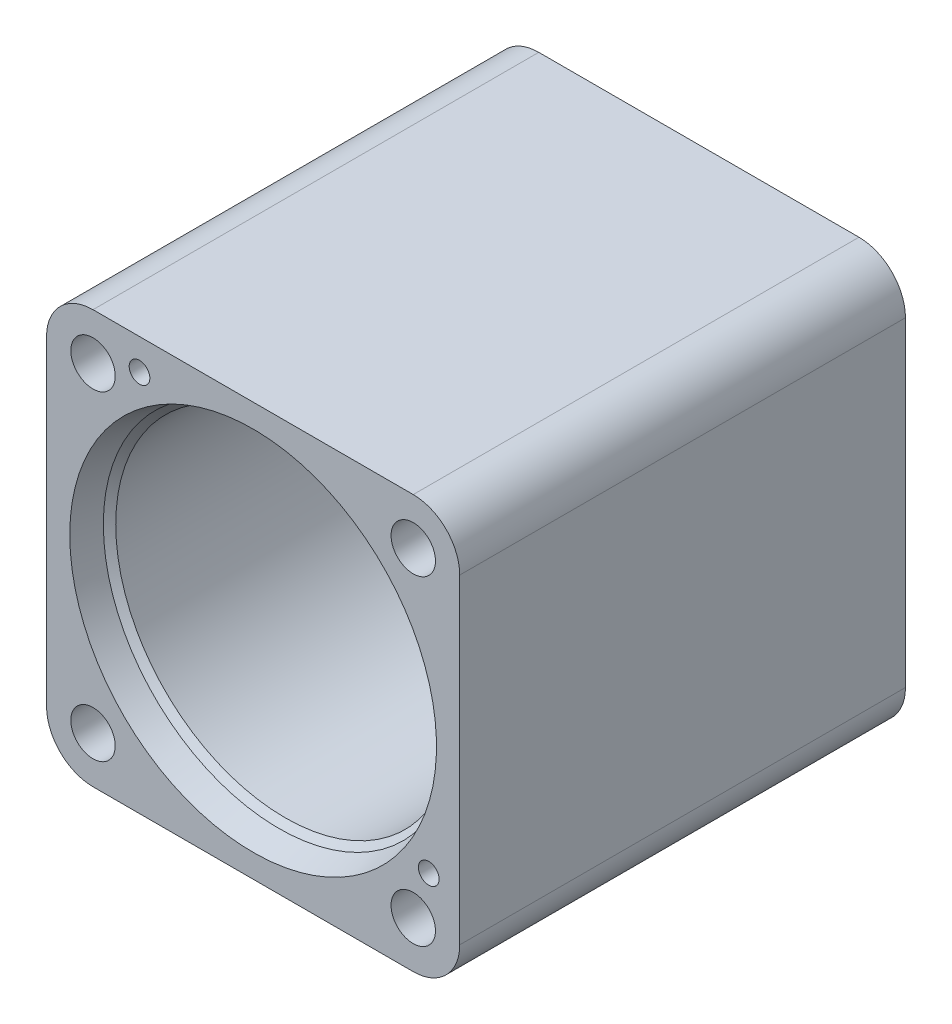
from build123d import *

# Parameters (mm, degrees)
SKETCH1_R           = 16.4
SKETCH1_R_2         = 2.15
BOSS_EXTRUDE1_DEPTH = 43.15
SKETCH6_R           = 1
CUT_EXTRUDE1_DEPTH  = 5


with BuildPart() as part:
    # Sketch1 → Boss-Extrude1 (new body)
    with BuildSketch(Plane.XY):
        with BuildLine():
            Line((-15.5, -20), (15.5, -20))
            ThreePointArc((15.5, -20), (18.681980515, -18.681980515), (20, -15.5))
            Line((20, -15.5), (20, 15.5))
            ThreePointArc((20, 15.5), (18.681980515, 18.681980515), (15.5, 20))
            Line((15.5, 20), (-15.5, 20))
            ThreePointArc((-15.5, 20), (-18.681980515, 18.681980515), (-20, 15.5))
            Line((-20, 15.5), (-20, -15.5))
            ThreePointArc((-20, -15.5), (-18.681980515, -18.681980515), (-15.5, -20))
        make_face()
        Circle(SKETCH1_R, mode=Mode.SUBTRACT)
        with Locations((-15.5, 15.5)):
            Circle(SKETCH1_R_2, mode=Mode.SUBTRACT)
        with Locations((15.5, 15.5)):
            Circle(SKETCH1_R_2, mode=Mode.SUBTRACT)
        with Locations((15.5, -15.5)):
            Circle(SKETCH1_R_2, mode=Mode.SUBTRACT)
        with Locations((-15.5, -15.5)):
            Circle(SKETCH1_R_2, mode=Mode.SUBTRACT)
    extrude(amount=BOSS_EXTRUDE1_DEPTH)

    # Sketch5 → Cut-Revolve1 (revolve, cut)
    with BuildSketch(Plane(origin=(0, 0, 0), x_dir=(1, 0, 0), z_dir=(0, 1, 0)), mode=Mode.PRIVATE) as cut_revolve1_sk:
        Polygon((16.4, -3.1), (17, -2.5), (17.75, 0), (16.4, 0), align=None)
    cut_revolve1 = revolve(cut_revolve1_sk.sketch.rotate(Axis((0, 0, -2.15), (0, 0, 1)), 180), axis=Axis((0, 0, -2.15), (0, 0, 1)), mode=Mode.SUBTRACT)

    # Mirror1: Cut-Revolve1 across plane
    add(cut_revolve1.mirror(Plane(origin=(0, 0, 21.575), x_dir=(1, 0, 0), z_dir=(0, 0, -1))), mode=Mode.SUBTRACT)

    # Sketch6 → Cut-Extrude1 (cut)
    with BuildSketch(Plane.XY.offset(43.15)):
        with Locations((-11, 17)):
            Circle(SKETCH6_R)
        with Locations(Location((17, -11, 0), (0, 0, 180))):
            Circle(SKETCH6_R)
    extrude(amount=-CUT_EXTRUDE1_DEPTH, mode=Mode.SUBTRACT)


solid = part.part
